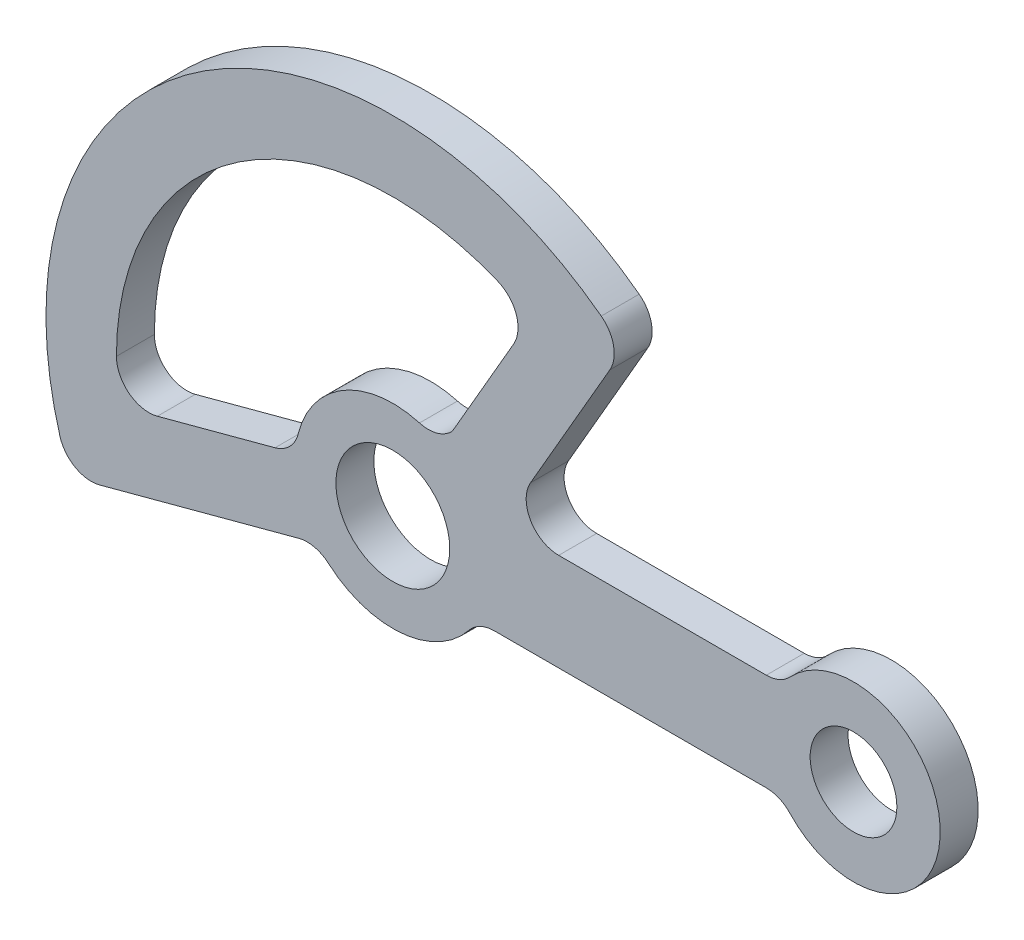
from build123d import *

# Parameters (mm, degrees)
SKETCH2_R           = 8
SKETCH2_R_2         = 10.5
BOSS_EXTRUDE2_DEPTH = 7


with BuildPart() as part:
    # Sketch2 → Boss-Extrude2 (new body)
    with BuildSketch(Plane.XY):
        with BuildLine():
            ThreePointArc((18.734993995, -9), (16.136917784, -9.591673087), (14.051245496, -11.25))
            ThreePointArc((14.051245496, -11.25), (1.588158791, -17.929800658), (-11.855019266, -13.544685977))
            ThreePointArc((-11.855019266, -13.544685977), (-14.447084602, -12.215655673), (-17.359606625, -12.264026344))
            Line((-17.359606625, -12.264026344), (-54.105315802, -22.110009444))
            ThreePointArc((-54.105315802, -22.110009444), (-58.597408553, -21.545250779), (-61.415978011, -18.002156674))
            ThreePointArc((-61.415978011, -18.002156674), (-36.436152523, 52.615651562), (38.455388874, 51.158411493))
            ThreePointArc((38.455388874, 51.158411493), (40.729032534, 47.562011618), (40.04634859, 43.362310416))
            Line((40.04634859, 43.362310416), (25.403411844, 18))
            ThreePointArc((25.403411844, 18), (25.403411844, 12), (30.599564267, 9))
            Line((30.599564267, 9), (68.906523061, 9))
            ThreePointArc((68.906523061, 9), (71.299695166, 9.497934272), (73.295653135, 10.909090909))
            ThreePointArc((73.295653135, 10.909090909), (101, 0), (73.295653135, -10.909090909))
            ThreePointArc((73.295653135, -10.909090909), (71.299695166, -9.497934272), (68.906523061, -9))
            Line((68.906523061, -9), (18.734993995, -9))
        make_face()
        with Locations((85, 0)):
            Circle(SKETCH2_R, mode=Mode.SUBTRACT)
        Circle(SKETCH2_R_2, mode=Mode.SUBTRACT)
        with BuildLine():
            ThreePointArc((10.98874406, 19.033063022), (8.199770085, 17.312416637), (4.922729046, 17.313773094))
            ThreePointArc((4.922729046, 17.313773094), (-9.01320029, 15.580828622), (-17.462949753, 4.364101961))
            ThreePointArc((-17.462949753, 4.364101961), (-19.005575236, 1.612182259), (-21.731018733, 0.023247657))
            Line((-21.731018733, 0.023247657), (-43.447085729, -5.795554958))
            ThreePointArc((-43.447085729, -5.795554958), (-48.652568574, -4.760120042), (-51, 0))
            ThreePointArc((-51, 0), (-28.394096654, 42.364788152), (19.383344125, 47.172936845))
            ThreePointArc((19.383344125, 47.172936845), (22.781794932, 43.559859246), (22.299103121, 38.623179569))
            Line((22.299103121, 38.623179569), (10.98874406, 19.033063022))
        make_face(mode=Mode.SUBTRACT)
    extrude(amount=BOSS_EXTRUDE2_DEPTH)


solid = part.part
